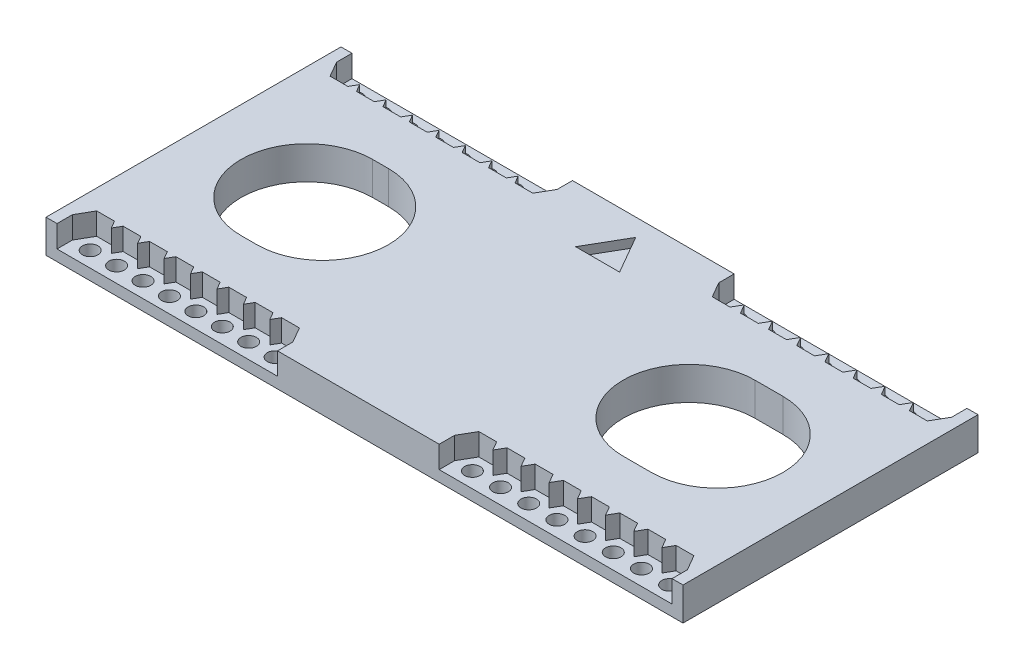
from build123d import *

# Parameters (mm, degrees)
SKETCH1_W           = 183.739955438
SKETCH1_H           = 42.541825
SKETCH1_R           = 2.2479
BOSS_EXTRUDE1_DEPTH = 9.525
SKETCH1_5_R         = 2.2479
CUT_EXTRUDE1_DEPTH  = 6.35
CUT_EXTRUDE2_DEPTH  = 181.771443479
CUT_EXTRUDE3_DEPTH  = 2.54


with BuildPart() as part:
    # Sketch1 → Boss-Extrude1 (new body)
    with BuildSketch(Plane(origin=(0, 0, 0), x_dir=(1, 0, 0), z_dir=(0, 1, 0))):
        with Locations((83.566, 21.2709125)):
            Rectangle(SKETCH1_W, SKETCH1_H)
        with Locations(Location((45.72, 38.1, 0), (0, 0, 270))):
            Circle(SKETCH1_R, mode=Mode.SUBTRACT)
        with Locations(Location((38.1, 38.1, 0), (0, 0, 270))):
            Circle(SKETCH1_R, mode=Mode.SUBTRACT)
        with Locations(Location((30.48, 38.1, 0), (0, 0, 270))):
            Circle(SKETCH1_R, mode=Mode.SUBTRACT)
        with Locations(Location((22.86, 38.1, 0), (0, 0, 270))):
            Circle(SKETCH1_R, mode=Mode.SUBTRACT)
        with Locations(Location((15.24, 38.1, 0), (0, 0, 270))):
            Circle(SKETCH1_R, mode=Mode.SUBTRACT)
        with Locations(Location((7.62, 38.1, 0), (0, 0, 270))):
            Circle(SKETCH1_R, mode=Mode.SUBTRACT)
        with Locations(Location((0, 38.1, 0), (0, 0, 270))):
            Circle(SKETCH1_R, mode=Mode.SUBTRACT)
        with Locations(Location((53.34, 38.1, 0), (0, 0, 270))):
            Circle(SKETCH1_R, mode=Mode.SUBTRACT)
        with Locations(Location((142.748, 38.1, 0), (0, 0, 270))):
            Circle(SKETCH1_R, mode=Mode.SUBTRACT)
        with Locations(Location((134.62, 38.1, 0), (0, 0, 270))):
            Circle(SKETCH1_R, mode=Mode.SUBTRACT)
        with Locations(Location((126.492, 38.1, 0), (0, 0, 270))):
            Circle(SKETCH1_R, mode=Mode.SUBTRACT)
        with Locations(Location((118.364, 38.1, 0), (0, 0, 270))):
            Circle(SKETCH1_R, mode=Mode.SUBTRACT)
        with Locations(Location((110.236, 38.1, 0), (0, 0, 270))):
            Circle(SKETCH1_R, mode=Mode.SUBTRACT)
        with Locations(Location((150.876, 38.1, 0), (0, 0, 270))):
            Circle(SKETCH1_R, mode=Mode.SUBTRACT)
        with Locations(Location((159.004, 38.1, 0), (0, 0, 270))):
            Circle(SKETCH1_R, mode=Mode.SUBTRACT)
        with Locations(Location((167.132, 38.1, 0), (0, 0, 270))):
            Circle(SKETCH1_R, mode=Mode.SUBTRACT)
    extrude(amount=-BOSS_EXTRUDE1_DEPTH)

    # Sketch1<5> → Cut-Extrude1 (cut)
    # profile 1 of 2: a face of its own
    with BuildSketch(Plane(origin=(0, 0, 0), x_dir=(1, 0, 0), z_dir=(0, 1, 0))):
        Polygon((-5.128977719, 38.1), (-2.564488859, 33.658175), (2.564488859, 33.658175), (3.81, 35.815463577), (5.055511141, 33.658175), (10.184488859, 33.658175), (11.43, 35.815463577), (12.675511141, 33.658175), (17.804488859, 33.658175), (19.05, 35.815463577), (20.295511141, 33.658175), (25.424488859, 33.658175), (26.67, 35.815463577), (27.915511141, 33.658175), (33.044488859, 33.658175), (34.29, 35.815463577), (35.535511141, 33.658175), (40.664488859, 33.658175), (41.91, 35.815463577), (43.155511141, 33.658175), (48.284488859, 33.658175), (49.53, 35.815463577), (50.775511141, 33.658175), (55.904488859, 33.658175), (58.468977719, 38.1), (58.468977719, 42.541825), (-5.128977719, 42.541825), align=None)
        with Locations((0, 38.1)):
            Circle(SKETCH1_5_R, mode=Mode.SUBTRACT)
        with Locations((7.62, 38.1)):
            Circle(SKETCH1_5_R, mode=Mode.SUBTRACT)
        with Locations((15.24, 38.1)):
            Circle(SKETCH1_5_R, mode=Mode.SUBTRACT)
        with Locations((22.86, 38.1)):
            Circle(SKETCH1_5_R, mode=Mode.SUBTRACT)
        with Locations((30.48, 38.1)):
            Circle(SKETCH1_5_R, mode=Mode.SUBTRACT)
        with Locations((38.1, 38.1)):
            Circle(SKETCH1_5_R, mode=Mode.SUBTRACT)
        with Locations((45.72, 38.1)):
            Circle(SKETCH1_5_R, mode=Mode.SUBTRACT)
        with Locations((53.34, 38.1)):
            Circle(SKETCH1_5_R, mode=Mode.SUBTRACT)
    # profile 2 of 2: a face of its own
    with BuildSketch(Plane(origin=(0, 0, 0), x_dir=(1, 0, 0), z_dir=(0, 1, 0))):
        Polygon((164.567511141, 33.658175), (169.696488859, 33.658175), (172.260977719, 38.1), (172.260977719, 42.541825), (105.107022281, 42.541825), (105.107022281, 38.1), (107.671511141, 33.658175), (112.800488859, 33.658175), (114.3, 36.255404482), (115.799511141, 33.658175), (120.928488859, 33.658175), (122.428, 36.255404482), (123.927511141, 33.658175), (129.056488859, 33.658175), (130.556, 36.255404482), (132.055511141, 33.658175), (137.184488859, 33.658175), (138.684, 36.255404482), (140.183511141, 33.658175), (145.312488859, 33.658175), (146.812, 36.255404482), (148.311511141, 33.658175), (153.440488859, 33.658175), (154.94, 36.255404482), (156.439511141, 33.658175), (161.568488859, 33.658175), (163.068, 36.255404482), align=None)
        with Locations((110.236, 38.1)):
            Circle(SKETCH1_5_R, mode=Mode.SUBTRACT)
        with Locations((118.364, 38.1)):
            Circle(SKETCH1_5_R, mode=Mode.SUBTRACT)
        with Locations((126.492, 38.1)):
            Circle(SKETCH1_5_R, mode=Mode.SUBTRACT)
        with Locations((134.62, 38.1)):
            Circle(SKETCH1_5_R, mode=Mode.SUBTRACT)
        with Locations((142.748, 38.1)):
            Circle(SKETCH1_5_R, mode=Mode.SUBTRACT)
        with Locations((150.876, 38.1)):
            Circle(SKETCH1_5_R, mode=Mode.SUBTRACT)
        with Locations((159.004, 38.1)):
            Circle(SKETCH1_5_R, mode=Mode.SUBTRACT)
        with Locations((167.132, 38.1)):
            Circle(SKETCH1_5_R, mode=Mode.SUBTRACT)
    extrude(amount=-CUT_EXTRUDE1_DEPTH, mode=Mode.SUBTRACT)

    # Mirror1: part across plane


with BuildPart() as part_1:
    add(part.part)
    add(part.part.mirror(Plane.XY))

    # Sketch2 → Cut-Extrude2 (cut, through all)
    with BuildSketch(Plane(origin=(0, 0, 0), x_dir=(1, 0, 0), z_dir=(0, 1, 0))):
        with BuildLine():
            Line((142.748, -19), (134.62, -19))
            ThreePointArc((134.62, -19), (115.62, 0), (134.62, 19))
            Line((134.62, 19), (142.748, 19))
            ThreePointArc((142.748, 19), (161.748, 0), (142.748, -19))
        make_face()
        with BuildLine():
            Line((28.956, -19), (24.384, -19))
            ThreePointArc((24.384, -19), (5.384, 0), (24.384, 19))
            Line((24.384, 19), (28.956, 19))
            ThreePointArc((28.956, 19), (47.956, 0), (28.956, -19))
        make_face()
    extrude(amount=-CUT_EXTRUDE2_DEPTH, mode=Mode.SUBTRACT)

    # Sketch4 → Cut-Extrude3 (cut)
    with BuildSketch(Plane(origin=(0, 0, 0), x_dir=(1, 0, 0), z_dir=(0, 1, 0))):
        Polygon((75.438, 26.463302372), (81.788, 37.461825), (88.138, 26.463302372), align=None)
    extrude(amount=-CUT_EXTRUDE3_DEPTH, mode=Mode.SUBTRACT)


solid = part_1.part
